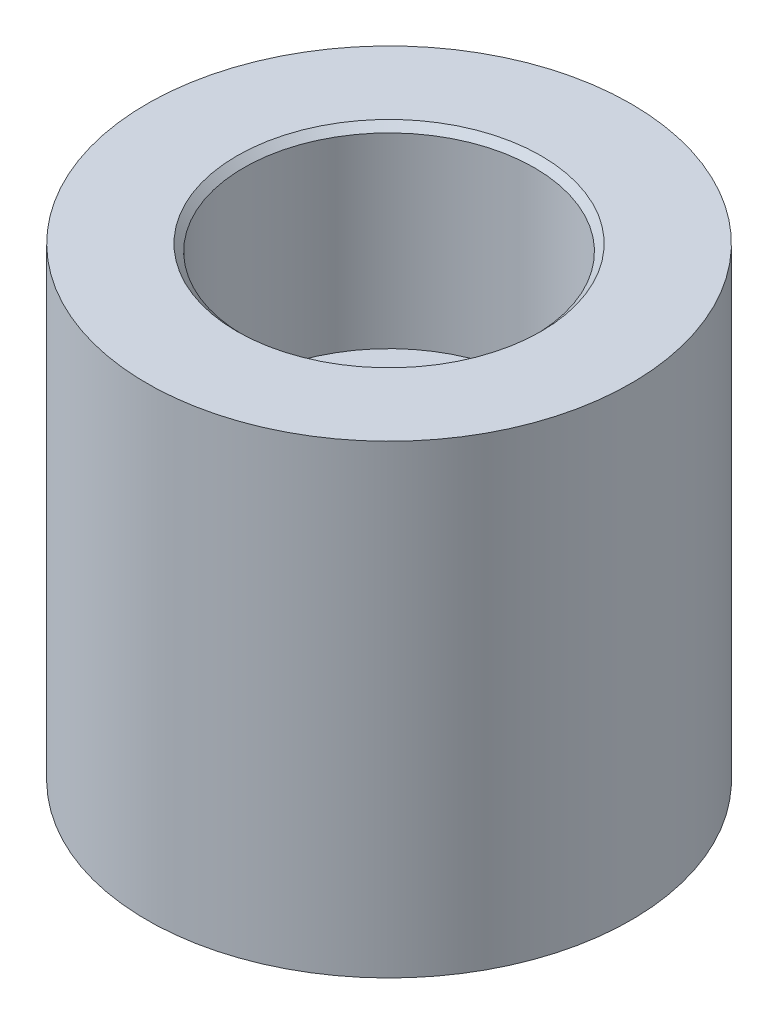
from build123d import *

# Parameters (mm, degrees)
SKETCH4_R          = 5
CUT_EXTRUDE1_DEPTH = 8
SKETCH5_R          = 3
CUT_EXTRUDE2_DEPTH = 48
SKETCH6_R          = 1
CUT_EXTRUDE3_DEPTH = 48


with BuildPart() as part:
    # Sketch2 → Revolve1 (revolve)
    with BuildSketch(Plane.XY, mode=Mode.PRIVATE) as revolve1_sk:
        Polygon((0, 0), (25, 0), (25, 3.419684485), (25, 48), (15.707106781, 48), (15, 47.292893219), (15, 28), (0, 28), align=None)
    revolve(revolve1_sk.sketch.rotate(Axis((0, 0, 0), (0, 1, 0)), 90), axis=Axis((0, 0, 0), (0, 1, 0)))

    # Sketch4 → Cut-Extrude1 (cut)
    with BuildSketch(Plane(origin=(0, 28, 0), x_dir=(1, 0, 0), z_dir=(0, 1, 0))):
        with Locations(Location((0, 0, 0), (0, 0, 270))):
            Circle(SKETCH4_R)
    extrude(amount=-CUT_EXTRUDE1_DEPTH, mode=Mode.SUBTRACT)

    # Sketch5 → Cut-Extrude2 (cut)
    with BuildSketch(Plane(origin=(0, 20, 0), x_dir=(1, 0, 0), z_dir=(0, 1, 0))):
        with Locations(Location((0, 0, 0), (0, 0, 270))):
            Circle(SKETCH5_R)
    extrude(amount=-CUT_EXTRUDE2_DEPTH, mode=Mode.SUBTRACT)

    # Sketch6 → Cut-Extrude3 (cut)
    with BuildSketch(Plane.XY):
        with Locations((0, 24)):
            Circle(SKETCH6_R)
    extrude(amount=-CUT_EXTRUDE3_DEPTH, mode=Mode.SUBTRACT)


solid = part.part
